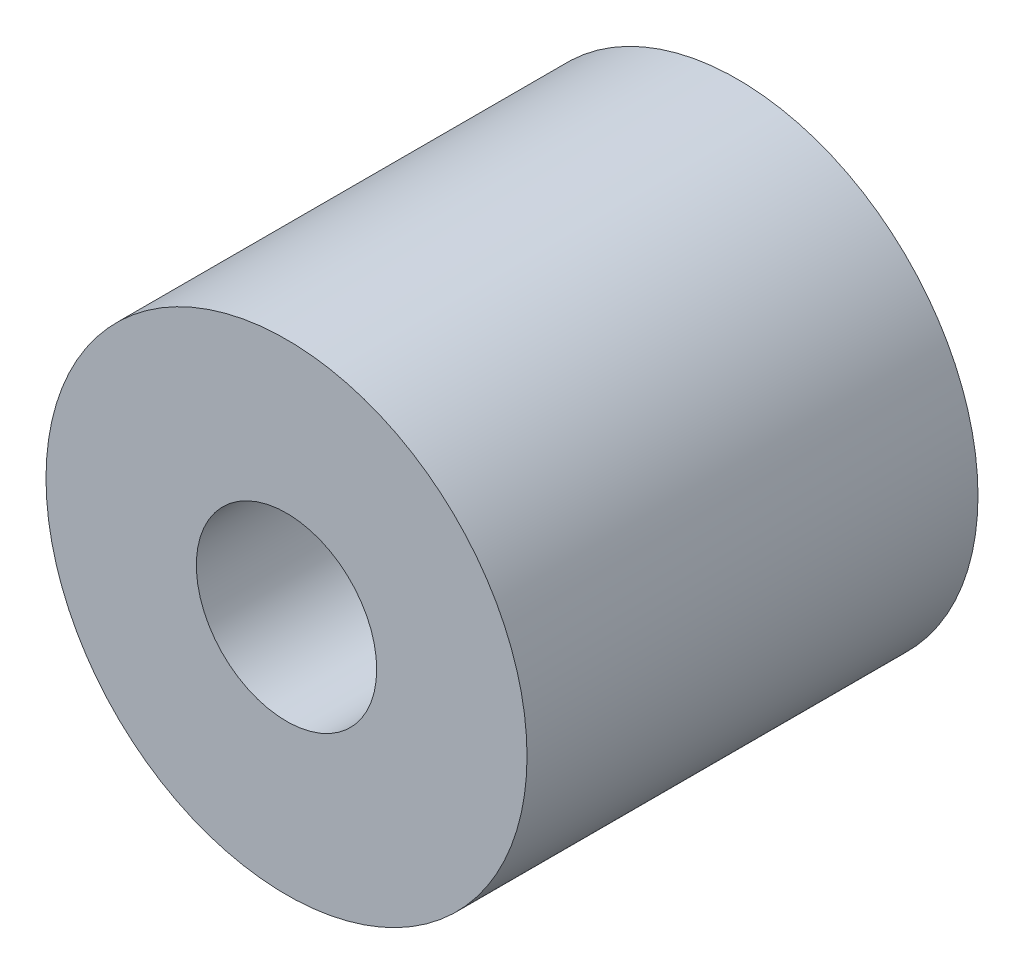
from build123d import *

# Parameters (mm, degrees)
ESBO_O1_R                = 8
ESBO_O1_R_2              = 3
RESSALTO_EXTRUS_O1_DEPTH = 7.5


with BuildPart() as part:
    # Esboço1 → Ressalto-extrusão1 (new, symmetric)
    with BuildSketch(Plane.XY):
        Circle(ESBO_O1_R)
        Circle(ESBO_O1_R_2, mode=Mode.SUBTRACT)
    extrude(amount=RESSALTO_EXTRUS_O1_DEPTH, both=True)


solid = part.part
